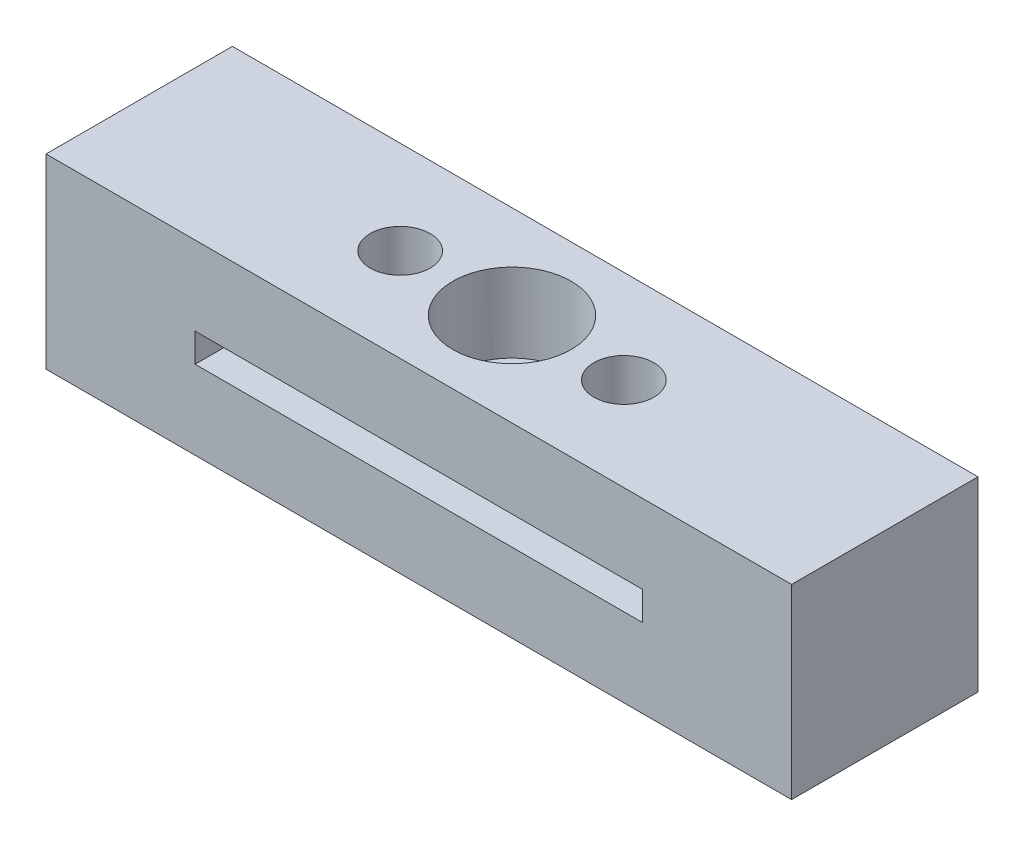
from build123d import *

# Parameters (mm, degrees)
SKETCH1_W               = 63.5
SKETCH1_H               = 15.875
SKETCH1_W_2             = 38.1
SKETCH1_H_2             = 2.446333072
BOSS_EXTRUDE1_DEPTH     = 7.9375
F_1_4_20_TAPPED_HOLE1_D = 5.1054
F_3_8_CLEARANCE_HOLE1_D = 10.0838


with BuildPart() as part:
    # Sketch1 → Boss-Extrude1 (new, symmetric)
    with BuildSketch(Plane.XY):
        Rectangle(SKETCH1_W, SKETCH1_H)
        Rectangle(SKETCH1_W_2, SKETCH1_H_2, mode=Mode.SUBTRACT)
    extrude(amount=BOSS_EXTRUDE1_DEPTH, both=True)

    # 1/4-20 Tapped Hole1 (through all)
    with Locations(Plane(origin=(0, 7.9375, 0), x_dir=(1, 0, 0), z_dir=(0, 1, 0))):
        with Locations((9.525, 0), (-9.525, 0)):
            Hole(F_1_4_20_TAPPED_HOLE1_D / 2)

    # 3/8 Clearance Hole1 (through all)
    with Locations(Plane(origin=(0, 7.9375, 0), x_dir=(1, 0, 0), z_dir=(0, 1, 0))):
        with Locations((0, 0)):
            Hole(F_3_8_CLEARANCE_HOLE1_D / 2)


solid = part.part
